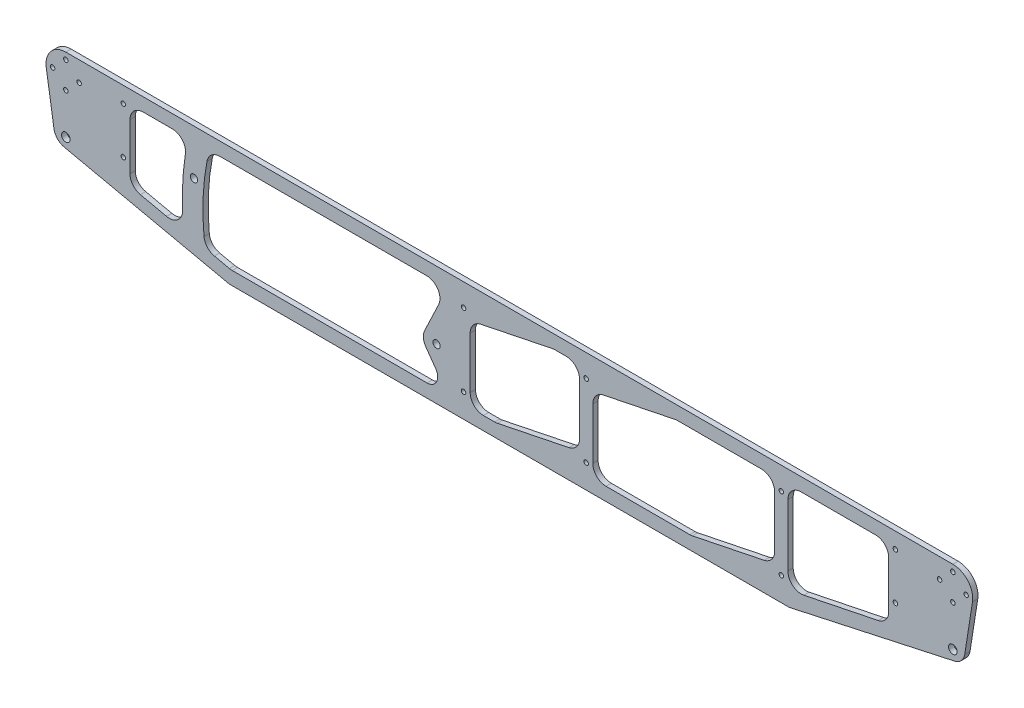
from build123d import *

# Parameters (mm, degrees)
SKETCH_1_R          = 3.25
EXTRUDE_1_DEPTH     = 4
HOLE_WIZARD_M32_D   = 3.4
HOLE_WIZARD_M52_D   = 5.5
CUT_EXTRUDE_3_DEPTH = 353.903669576
FILLET_2_R          = 10
FILLET_3_R          = 10
HOLE_WIZARD_M31_D   = 3.4
FILLET_4_R          = 8


with BuildPart() as part:
    # Эскиз1 → Бобышка-Вытянуть1 (new body)
    with BuildSketch(Plane.XY):
        with BuildLine():
            Line((-349.818316726, 27.672449915), (-342.910885265, -16.303620822))
            Line((-342.910885265, -16.303620822), (-211.481081006, -45))
            Line((-211.481081006, -45), (211.481081006, -45))
            Line((211.481081006, -45), (342.910885265, -16.303620822))
            Line((342.910885265, -16.303620822), (349.818316726, 27.672449915))
            ThreePointArc((349.818316726, 27.672449915), (346.399852001, 39.749019149), (335, 45))
            Line((335, 45), (-335, 45))
            ThreePointArc((-335, 45), (-346.399852001, 39.749019149), (-349.818316726, 27.672449915))
        make_face()
        with Locations((-335, -10.635315981)):
            Circle(SKETCH_1_R, mode=Mode.SUBTRACT)
        with Locations(Location((335, -10.635315981, 0), (0, 0, 180))):
            Circle(SKETCH_1_R, mode=Mode.SUBTRACT)
    extrude(amount=EXTRUDE_1_DEPTH)

    # Отверстие с зазором M32 (through all)
    with Locations(Plane.XY.offset(4)):
        with Locations((-335, 40), (-345, 30), (-335, 20), (-325, 30), (325, 30), (335, 40), (345, 30), (335, 20)):
            Hole(HOLE_WIZARD_M32_D / 2)

    # Отверстие с зазором M52 (through all)
    with Locations(Plane(origin=(0, 0, 0), x_dir=(-1, 0, 0), z_dir=(0, 0, -1))):
        with Locations((55, -6), (238.23, 10.84)):
            Hole(HOLE_WIZARD_M52_D / 2)

    # Эскиз10 → Вырез-Вытянуть3 (cut, through all)
    with BuildSketch(Plane.XY.offset(4)):
        with BuildLine():
            Line((-286.571319769, 35), (-242.571319769, 35))
            ThreePointArc((-242.571319769, 35), (-246.739453064, 3.999106889), (-245.818518827, -27.267178292))
            Line((-245.818518827, -27.267178292), (-286.571319769, -18.369213063))
            Line((-286.571319769, -18.369213063), (-286.571319769, 35))
        make_face()
        with BuildLine():
            Line((-226.671925486, 35), (-46.587816989, 35))
            Line((-46.587816989, 35), (-64.032014151, -1.707830342))
            ThreePointArc((-64.032014151, -1.707830342), (-64.961194769, -6.880112935), (-63.13950341, -11.809344562))
            Line((-63.13950341, -11.809344562), (-46.587816989, -35))
            Line((-46.587816989, -35), (-210.402090952, -35))
            Line((-210.402090952, -35), (-229.752534006, -30.775024894))
            ThreePointArc((-229.752534006, -30.775024894), (-231.306735573, 2.257420391), (-226.671925486, 35))
        make_face()
        Polygon((286.571319769, 35), (286.571319769, -18.369213063), (210.402090952, -34), (210.402090952, 35), align=None)
        Polygon((200.402090952, 35), (126.145146633, 35), (63.036502818, 22.049392771), (63.036502818, -35), (137.293447136, -35), (200.402090952, -22.049392771), align=None)
        Polygon((-29.597909048, 22.049392771), (-29.597909048, -35), (-10.072140997, -35), (53.036502818, -22.049392771), (53.036502818, 35), (33.510734767, 35), align=None)
    extrude(amount=-CUT_EXTRUDE_3_DEPTH, mode=Mode.SUBTRACT)

    # Скругление2
    fillet_2_edges = [part.edges().sort_by_distance(p)[0] for p in [
        (210.402090952, 35, 2),
        (286.571319769, 35, 2),
        (286.571319769, -18.369213063, 2),
        (210.402090952, -34, 2),
        (-210.402090952, -35, 2),
        (-229.752534006, -30.775024894, 2),
        (-226.671925486, 35, 2),
        (-46.587816989, 35, 2),
        (342.910885265, -16.303620822, 2),
        (211.481081006, -45, 2),
        (-211.481081006, -45, 2),
        (-342.910885265, -16.303620822, 2),
        (-286.571319769, -18.369213063, 2),
        (-286.571319769, 35, 2),
        (-242.571319769, 35, 2),
        (-245.818518827, -27.267178292, 2),
    ]]
    fillet(fillet_2_edges, radius=FILLET_2_R)

    # Скругление3
    fillet_3_edges = [part.edges().sort_by_distance(p)[0] for p in [
        (63.036502818, 22.049392771, 2),
        (126.145146633, 35, 2),
        (200.402090952, 35, 2),
        (200.402090952, -22.049392771, 2),
        (137.293447136, -35, 2),
        (63.036502818, -35, 2),
        (33.510734767, 35, 2),
        (53.036502818, 35, 2),
        (53.036502818, -22.049392771, 2),
        (-10.072140997, -35, 2),
        (-29.597909048, -35, 2),
        (-29.597909048, 22.049392771, 2),
    ]]
    fillet(fillet_3_edges, radius=FILLET_3_R)

    # Отверстие с зазором M31 (through all)
    with Locations(Plane.XY.offset(4)):
        with Locations((-34.597909048, 28), (-34.597909048, -27), (205.402090952, -27), (205.402090952, 28), (291.571319769, 33), (291.6163356, -2), (-291.6163356, -2), (-291.571319769, 33), (58.036502818, 28), (58.036502818, -27)):
            Hole(HOLE_WIZARD_M31_D / 2)

    # Скругление4
    fillet_4_edges = [part.edges().sort_by_distance(p)[0] for p in [
        (-46.587816989, -35, 2),
    ]]
    fillet(fillet_4_edges, radius=FILLET_4_R)


solid = part.part
